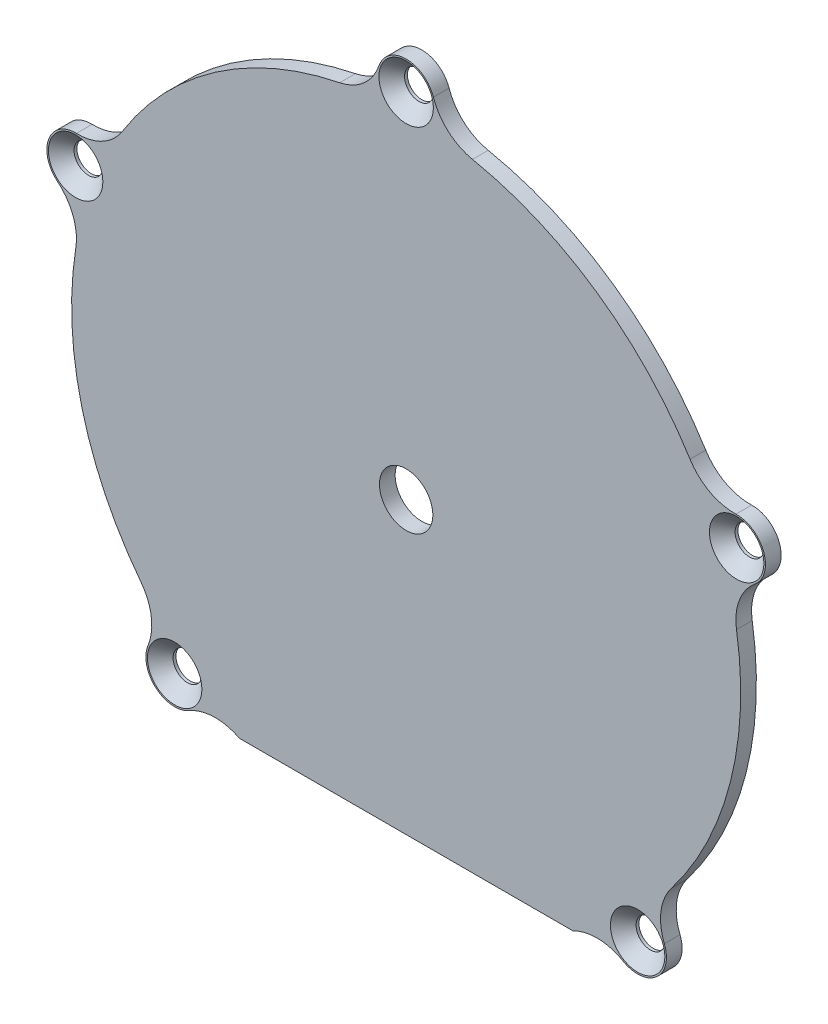
from build123d import *

# Parameters (mm, degrees)
BOSS_EXTRUDE1_DEPTH                          = 3
CSK_FOR_M5_COUNTERSUNK_FLAT_HEAD_SCR_2_COUNT = 2
CSK_FOR_M5_COUNTERSUNK_FLAT_HEAD_SCR_2_PITCH = 76.842304832
CSK_FOR_M5_COUNTERSUNK_FLAT_HEAD_SCR_3_COUNT = 2
CSK_FOR_M5_COUNTERSUNK_FLAT_HEAD_SCR_3_PITCH = 126.274488939
CSK_FOR_M5_COUNTERSUNK_FLAT_HEAD_SCR_4_COUNT = 2
CSK_FOR_M5_COUNTERSUNK_FLAT_HEAD_SCR_4_PITCH = 130.663789522
CSK_FOR_M5_COUNTERSUNK_FLAT_HEAD_SCR_5_COUNT = 2
CSK_FOR_M5_COUNTERSUNK_FLAT_HEAD_SCR_5_PITCH = 76.842304832
SKETCH7_R                                    = 5.1
CUT_EXTRUDE1_DEPTH                           = 101.176561813


with BuildPart() as part:
    # Sketch1 → Boss-Extrude1 (new body)
    with BuildSketch(Plane.XY):
        with BuildLine():
            Line((-31.845730134, -55.405913397), (0, -55.405913397))
            Line((0, -55.405913397), (31.845730134, -55.405913397))
            ThreePointArc((31.845730134, -55.405913397), (36.683914759, -54.28538737), (41.464515841, -55.630549937))
            ThreePointArc((41.464515841, -55.630549937), (47.829334185, -55.023876328), (49.319655375, -48.806327923))
            ThreePointArc((49.319655375, -48.806327923), (48.678987264, -43.702284601), (50.66032125, -38.955071786))
            ThreePointArc((50.66032125, -38.955071786), (61.939586577, -15.730651027), (63.108911007, 10.061367629))
            ThreePointArc((63.108911007, 10.061367629), (63.632854976, 15.178710356), (66.631324059, 19.35853057))
            ThreePointArc((66.631324059, 19.35853057), (68.28894151, 25.532189009), (62.987637378, 29.104013283))
            ThreePointArc((62.987637378, 29.104013283), (57.982455244, 30.291390926), (54.229750811, 33.809760336))
            ThreePointArc((54.229750811, 33.809760336), (36.426163747, 52.508098059), (12.677003214, 62.635927043))
            ThreePointArc((12.677003214, 62.635927043), (8.067219644, 64.918821983), (5.202184299, 69.191208475))
            ThreePointArc((5.202184299, 69.191208475), (0, 72.905913397), (-5.202184299, 69.191208475))
            ThreePointArc((-5.202184299, 69.191208475), (-8.067219644, 64.918821983), (-12.677003214, 62.635927043))
            ThreePointArc((-12.677003214, 62.635927043), (-36.426163747, 52.508098059), (-54.229750811, 33.809760336))
            ThreePointArc((-54.229750811, 33.809760336), (-57.982455244, 30.291390926), (-62.987637378, 29.104013283))
            ThreePointArc((-62.987637378, 29.104013283), (-68.28894151, 25.532189009), (-66.631324059, 19.35853057))
            ThreePointArc((-66.631324059, 19.35853057), (-63.632854976, 15.178710356), (-63.108911007, 10.061367629))
            ThreePointArc((-63.108911007, 10.061367629), (-61.939586577, -15.730651027), (-50.66032125, -38.955071786))
            ThreePointArc((-50.66032125, -38.955071786), (-48.678987264, -43.702284601), (-49.319655375, -48.806327923))
            ThreePointArc((-49.319655375, -48.806327923), (-47.829334185, -55.023876328), (-41.464515841, -55.630549937))
            ThreePointArc((-41.464515841, -55.630549937), (-36.683914759, -54.28538737), (-31.845730134, -55.405913397))
        make_face()
    extrude(amount=BOSS_EXTRUDE1_DEPTH)

    # Sketch3 → CSK for M5 Countersunk Flat Head Screw1 (revolve, cut)
    with BuildSketch(Plane(origin=(-63.13724447, 23.606048412, 3), x_dir=(0, -1, 0), z_dir=(1, 0, 0))):
        Polygon((0, 0), (0, 3), (2.75, 3), (2.75, 2.45), (5.2, 0), align=None)
    csk_for_m5_countersunk_flat_head_screw1 = revolve(axis=Axis((-63.13724447, 23.606048412, 9.35), (0, 0, -1)), mode=Mode.SUBTRACT)

    # CSK for M5 Countersunk Flat Head Scr 2: CSK for M5 Countersunk Flat Head Screw1 ×2
    with Locations(*[Vector(0.8216469379421629, 0.5699967625963042, 0) * (i * CSK_FOR_M5_COUNTERSUNK_FLAT_HEAD_SCR_2_PITCH) for i in range(1, CSK_FOR_M5_COUNTERSUNK_FLAT_HEAD_SCR_2_COUNT)]):
        add(csk_for_m5_countersunk_flat_head_screw1, mode=Mode.SUBTRACT)

    # CSK for M5 Countersunk Flat Head Scr 3: CSK for M5 Countersunk Flat Head Screw1 ×2
    with Locations(*[(i * CSK_FOR_M5_COUNTERSUNK_FLAT_HEAD_SCR_3_PITCH, 0, 0) for i in range(1, CSK_FOR_M5_COUNTERSUNK_FLAT_HEAD_SCR_3_COUNT)]):
        add(csk_for_m5_countersunk_flat_head_screw1, mode=Mode.SUBTRACT)

    # CSK for M5 Countersunk Flat Head Scr 4: CSK for M5 Countersunk Flat Head Screw1 ×2
    with Locations(*[Vector(0.8216469379421629, -0.5699967625963043, 0) * (i * CSK_FOR_M5_COUNTERSUNK_FLAT_HEAD_SCR_4_PITCH) for i in range(1, CSK_FOR_M5_COUNTERSUNK_FLAT_HEAD_SCR_4_COUNT)]):
        add(csk_for_m5_countersunk_flat_head_screw1, mode=Mode.SUBTRACT)

    # CSK for M5 Countersunk Flat Head Scr 5: CSK for M5 Countersunk Flat Head Screw1 ×2
    with Locations(*[Vector(0.24615329302899694, -0.9692309097067534, 0) * (i * CSK_FOR_M5_COUNTERSUNK_FLAT_HEAD_SCR_5_PITCH) for i in range(1, CSK_FOR_M5_COUNTERSUNK_FLAT_HEAD_SCR_5_COUNT)]):
        add(csk_for_m5_countersunk_flat_head_screw1, mode=Mode.SUBTRACT)

    # Sketch7 → Cut-Extrude1 (cut, through all)
    with BuildSketch(Plane.XY.offset(3)):
        Circle(SKETCH7_R)
    extrude(amount=-CUT_EXTRUDE1_DEPTH, mode=Mode.SUBTRACT)


solid = part.part
